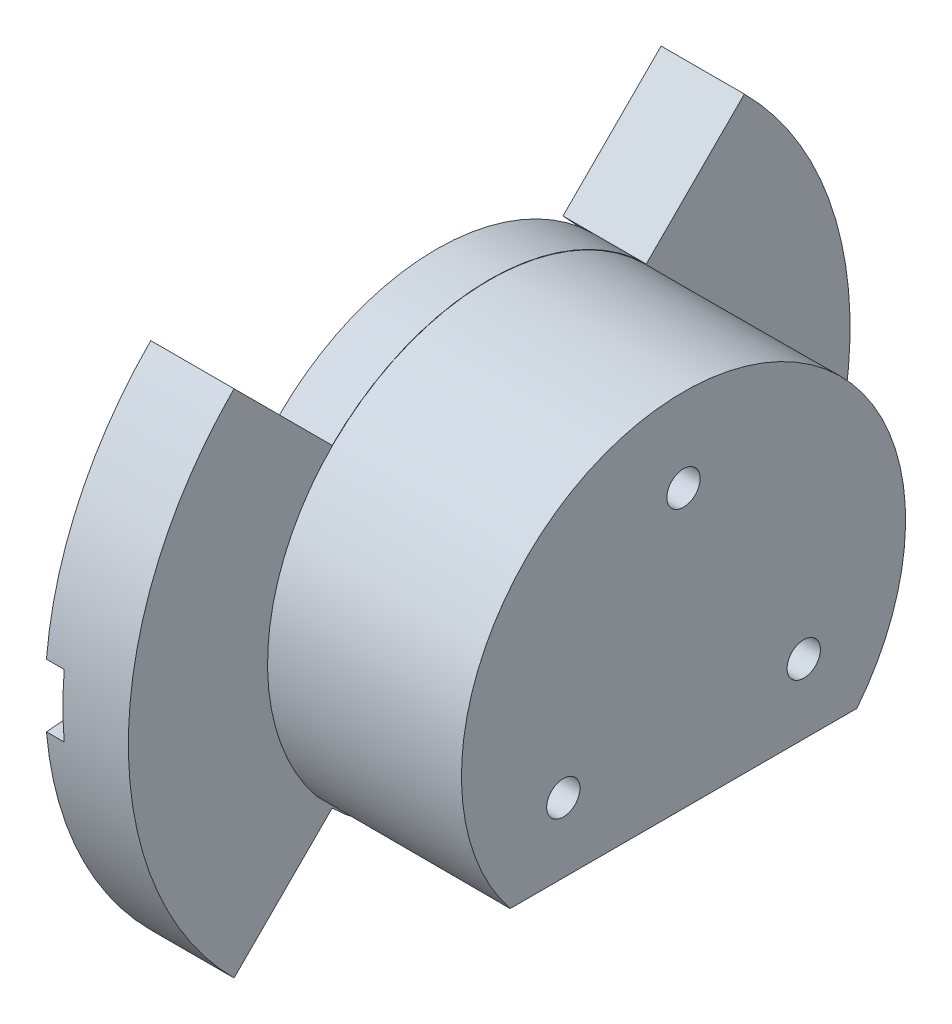
from build123d import *

# Parameters (mm, degrees)
CORTAR_EXTRUIR2_DEPTH  = 7.5
CROQUIS5_R             = 1.5
CORTAR_EXTRUIR4_DEPTH  = 25
CORTAR_EXTRUIR14_DEPTH = 1.6
CORTAR_EXTRUIR15_DEPTH = 18
CORTAR_EXTRUIR18_DEPTH = 17.5
CROQUIS21_R            = 1
CORTAR_EXTRUIR19_DEPTH = 12.5
CROQUIS22_R            = 3.25
CORTAR_EXTRUIR20_DEPTH = 5.5


with BuildPart() as part:
    # Croquis1 → Revolución1 (revolve)
    with BuildSketch(Plane(origin=(0, 0, 0), x_dir=(1, 0, 0), z_dir=(0, 1, 0)), mode=Mode.PRIVATE) as revoluci_n1_sk:
        Polygon((0, 0), (25, 0), (25, 20), (7.5, 19.966144384), (7.5, 32.5), (0, 32.5), (0, 20), (2.75, 20), (2.75, 10), (0, 10), align=None)
    revolve(revoluci_n1_sk.sketch.rotate(Axis((0, 0, 0), (1, 0, 0)), 180), axis=Axis((0, 0, 0), (1, 0, 0)))

    # Croquis2 → Cortar-Extruir2 (cut)
    with BuildSketch(Plane.ZY):
        with BuildLine():
            ThreePointArc((-14.142135624, 14.142135624), (0, 20), (14.142135624, 14.142135624))
            Line((14.142135624, 14.142135624), (22.980970389, 22.980970389))
            ThreePointArc((22.980970389, 22.980970389), (0, 32.5), (-22.980970389, 22.980970389))
            Line((-22.980970389, 22.980970389), (-14.142135624, 14.142135624))
        make_face()
        with BuildLine():
            Line((22.980970389, -22.980970389), (14.142135624, -14.142135624))
            ThreePointArc((14.142135624, -14.142135624), (0, -20), (-14.142135624, -14.142135624))
            Line((-14.142135624, -14.142135624), (-22.980970389, -22.980970389))
            ThreePointArc((-22.980970389, -22.980970389), (0, -32.5), (22.980970389, -22.980970389))
        make_face()
    extrude(amount=-CORTAR_EXTRUIR2_DEPTH, mode=Mode.SUBTRACT)

    # Croquis5 → Cortar-Extruir4 (cut)
    with BuildSketch(Plane(origin=(25, 0, 0), x_dir=(0, 0, -1), z_dir=(1, 0, 0))):
        with Locations((0, 12.5)):
            Circle(CROQUIS5_R)
        with Locations((10.825317547, -6.25)):
            Circle(CROQUIS5_R)
        with Locations((-10.825317547, -6.25)):
            Circle(CROQUIS5_R)
    extrude(amount=-CORTAR_EXTRUIR4_DEPTH, mode=Mode.SUBTRACT)

    # Croquis17 → Cortar-Extruir14 (cut)
    with BuildSketch(Plane.ZY):
        with BuildLine():
            Line((26, 0), (32.5, 0))
            ThreePointArc((32.5, 0), (32.469067201, 1.417630089), (32.376327688, 2.832561639))
            Line((32.376327688, 2.832561639), (25.90106215, 2.266049311))
            ThreePointArc((25.90106215, 2.266049311), (25.975253761, 1.134104071), (26, 0))
        make_face()
        with BuildLine():
            ThreePointArc((32.376327688, -2.832561639), (32.469067201, -1.417630089), (32.5, 0))
            Line((32.5, 0), (26, 0))
            ThreePointArc((26, 0), (25.975253761, -1.134104071), (25.90106215, -2.266049311))
            Line((25.90106215, -2.266049311), (32.376327688, -2.832561639))
        make_face()
        with BuildLine():
            Line((-25.90106215, 2.266049311), (-32.376327688, 2.832561639))
            ThreePointArc((-32.376327688, 2.832561639), (-32.469067201, 1.417630089), (-32.5, 0))
            Line((-32.5, 0), (-26, 0))
            ThreePointArc((-26, 0), (-25.975253761, 1.134104071), (-25.90106215, 2.266049311))
        make_face()
        with BuildLine():
            ThreePointArc((-32.5, 0), (-32.469067201, -1.417630089), (-32.376327688, -2.832561639))
            Line((-32.376327688, -2.832561639), (-25.90106215, -2.266049311))
            ThreePointArc((-25.90106215, -2.266049311), (-25.975253761, -1.134104071), (-26, 0))
            Line((-26, 0), (-32.5, 0))
        make_face()
    extrude(amount=-CORTAR_EXTRUIR14_DEPTH, mode=Mode.SUBTRACT)

    # Croquis18 → Cortar-Extruir15 (cut)
    with BuildSketch(Plane.ZY):
        with BuildLine():
            Line((0, 0), (-1.86, 2.48))
            ThreePointArc((-1.86, 2.48), (-1.386362146, -2.772724292), (3.1, 0))
            ThreePointArc((3.1, 0), (2.772724292, 1.386362146), (1.86, 2.48))
            Line((1.86, 2.48), (0, 0))
        make_face()
        Polygon((0, 0), (-1.86, 2.48), (1.86, 2.48), align=None)
    extrude(amount=-CORTAR_EXTRUIR15_DEPTH, mode=Mode.SUBTRACT)

    # Croquis20 → Cortar-Extruir18 (cut)
    with BuildSketch(Plane(origin=(25, 0, 0), x_dir=(0, 0, -1), z_dir=(1, 0, 0))):
        with BuildLine():
            Line((0, -12.5), (-15.612494996, -12.5))
            ThreePointArc((-15.612494996, -12.5), (0, -20), (15.612494996, -12.5))
            Line((15.612494996, -12.5), (0, -12.5))
        make_face()
    extrude(amount=-CORTAR_EXTRUIR18_DEPTH, mode=Mode.SUBTRACT)

    # Croquis21 → Cortar-Extruir19 (cut)
    with BuildSketch(Plane.XZ.offset(12.5)):
        with Locations(Location((16, 0, 0), (0, 0, 270))):
            Circle(CROQUIS21_R)
    extrude(amount=-CORTAR_EXTRUIR19_DEPTH, mode=Mode.SUBTRACT)

    # Croquis22 → Cortar-Extruir20 (cut)
    with BuildSketch(Plane.ZY):
        with Locations((0, 12.5)):
            Circle(CROQUIS22_R)
        with Locations((10.825317547, -6.25)):
            Circle(CROQUIS22_R)
        with Locations((-10.825317547, -6.25)):
            Circle(CROQUIS22_R)
    extrude(amount=-CORTAR_EXTRUIR20_DEPTH, mode=Mode.SUBTRACT)


solid = part.part
